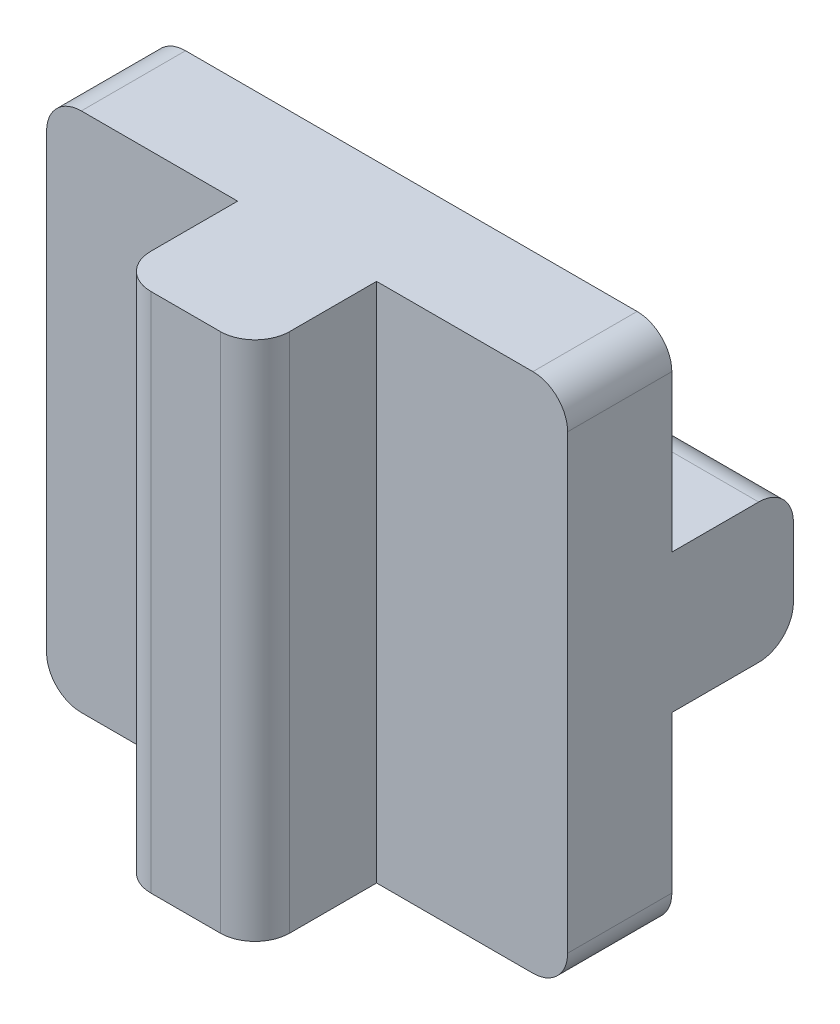
from build123d import *

# Parameters (mm, degrees)
SKETCH_1_W      = 30
SKETCH_1_H      = 30
EXTRUDE_1_DEPTH = 6
SKETCH_2_W      = 30
SKETCH_2_H      = 8
EXTRUDE_2_DEPTH = 7
FILLET_1_R      = 2
FILLET_2_R      = 2
SKETCH_3_W      = 8
SKETCH_3_H      = 30
EXTRUDE_3_DEPTH = 7
FILLET_3_R      = 2


with BuildPart() as part:
    # 스케치1 → 보스-돌출1 (new body)
    with BuildSketch(Plane.XY):
        Rectangle(SKETCH_1_W, SKETCH_1_H)
    extrude(amount=EXTRUDE_1_DEPTH)

    # 스케치2 → 보스-돌출2 (add)
    with BuildSketch(Plane(origin=(0, 0, 0), x_dir=(-1, 0, 0), z_dir=(0, 0, -1))):
        Rectangle(SKETCH_2_W, SKETCH_2_H)
    extrude(amount=EXTRUDE_2_DEPTH)

    # 필렛1
    fillet_1_edges = [part.edges().sort_by_distance(p)[0] for p in [
        (0, 4, -7),
        (0, -4, -7),
    ]]
    fillet(fillet_1_edges, radius=FILLET_1_R)

    # 필렛2
    fillet_2_edges = [part.edges().sort_by_distance(p)[0] for p in [
        (15, -15, 3),
        (-15, -15, 3),
        (-15, 15, 3),
        (15, 15, 3),
    ]]
    fillet(fillet_2_edges, radius=FILLET_2_R)

    # 스케치3 → 보스-돌출3 (add)
    with BuildSketch(Plane.XY.offset(6)):
        Rectangle(SKETCH_3_W, SKETCH_3_H)
    extrude(amount=EXTRUDE_3_DEPTH)

    # 필렛3
    fillet_3_edges = [part.edges().sort_by_distance(p)[0] for p in [
        (4, 0, 13),
        (-4, 0, 13),
    ]]
    fillet(fillet_3_edges, radius=FILLET_3_R)


solid = part.part
